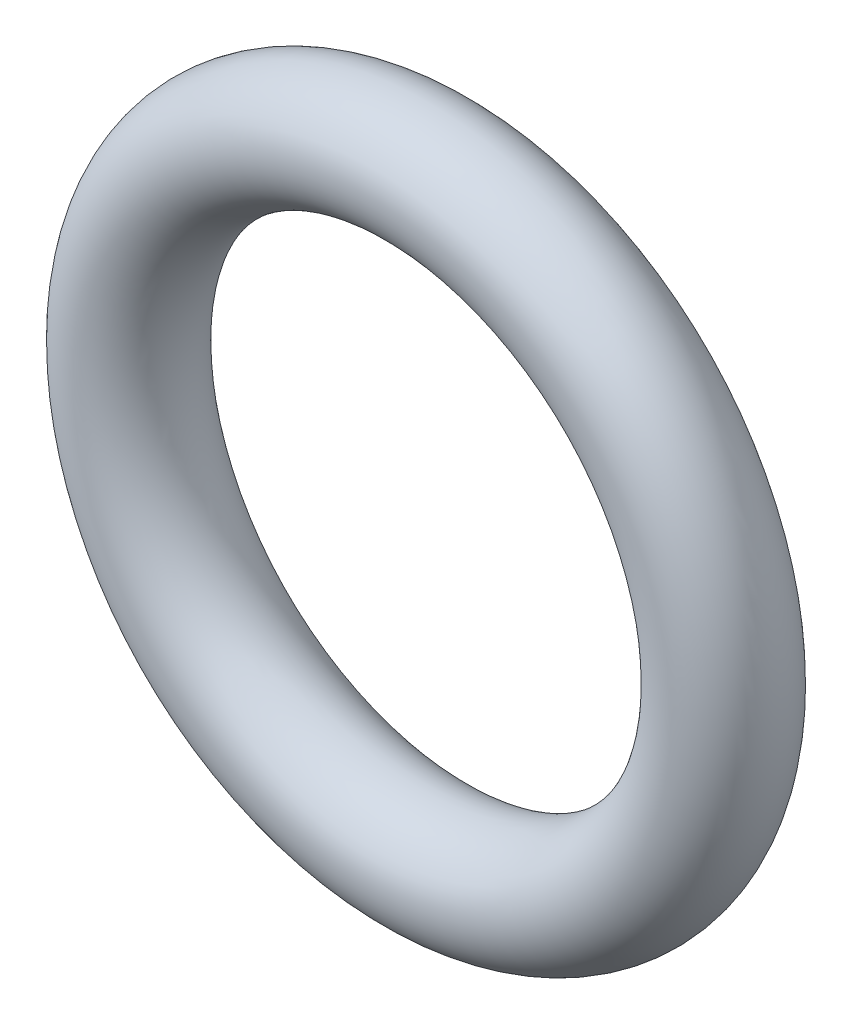
from build123d import *

# Parameters (mm, degrees)
SKETCH1_R = 1.3081


with BuildPart() as part:
    # Sketch1 → Revolve1 (revolve)
    with BuildSketch(Plane(origin=(0, 0, 0), x_dir=(0, -1, 0), z_dir=(1, 0, 0)), mode=Mode.PRIVATE) as revolve1_sk:
        with Locations((6.6929, 0)):
            Circle(SKETCH1_R)
    revolve(revolve1_sk.sketch.rotate(Axis((0, 0, 1.3081), (0, 0, -1)), 270), axis=Axis((0, 0, 1.3081), (0, 0, -1)))


solid = part.part
